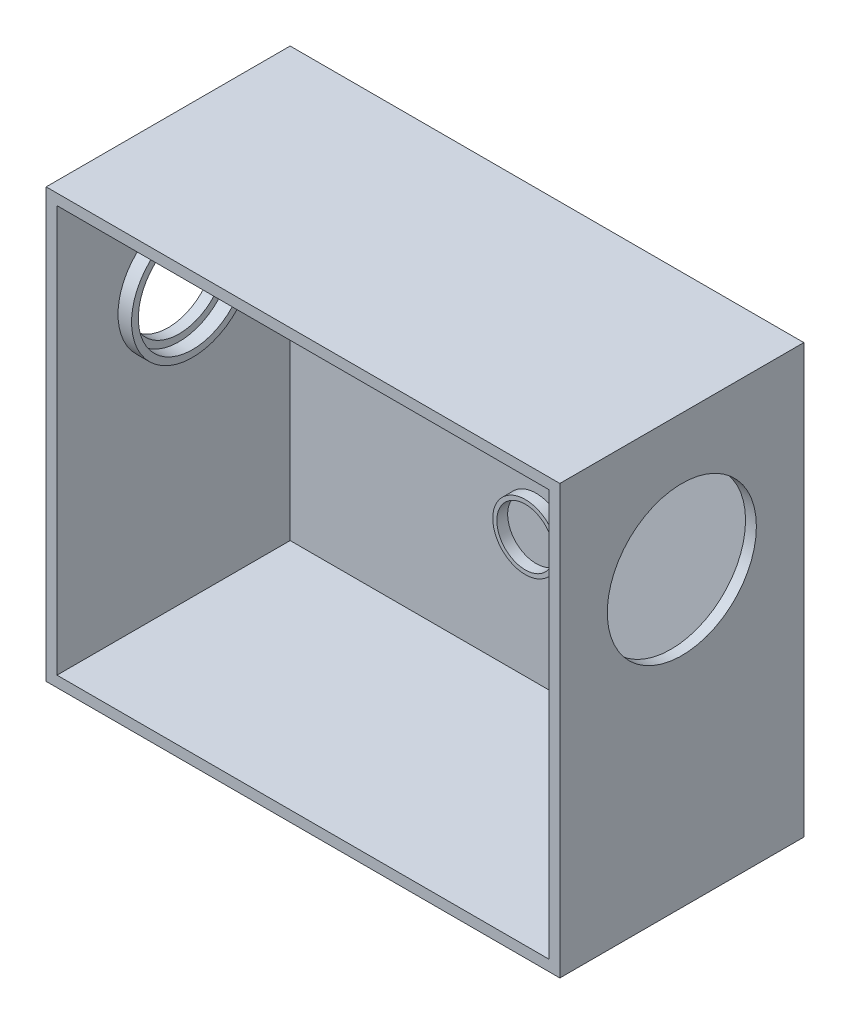
from build123d import *

# Parameters (mm, degrees)
CROQUIS1_W              = 379
CROQUIS1_H              = 316
SALIENTE_EXTRUIR1_DEPTH = 180
VACIADO1_T              = -8
CROQUIS2_R              = 35
CORTAR_EXTRUIR4_DEPTH   = 20
CROQUIS4_R              = 45
CROQUIS4_R_2            = 40
SALIENTE_EXTRUIR4_DEPTH = 10
CROQUIS6_R              = 55
CORTAR_EXTRUIR6_DEPTH   = 10
CROQUIS7_R              = 24
CROQUIS7_R_2            = 21
SALIENTE_EXTRUIR9_DEPTH = 8


with BuildPart() as part:
    # Croquis1 → Saliente-Extruir1 (new body)
    with BuildSketch(Plane.XY):
        Rectangle(CROQUIS1_W, CROQUIS1_H)
    extrude(amount=SALIENTE_EXTRUIR1_DEPTH)

    # Vaciado1
    vaciado1_openings = [part.faces().sort_by_distance(p)[0] for p in [
        (0, 0, 180),
    ]]
    offset(amount=VACIADO1_T, openings=vaciado1_openings, kind=Kind.INTERSECTION)

    # Croquis2 → Cortar-Extruir4 (cut)
    with BuildSketch(Plane.ZY.offset(189.5)):
        with Locations((90, 58)):
            Circle(CROQUIS2_R)
    extrude(amount=-CORTAR_EXTRUIR4_DEPTH, mode=Mode.SUBTRACT)

    # Croquis4 → Saliente-Extruir4 (add)
    with BuildSketch(Plane(origin=(-181.5, 0, 0), x_dir=(0, 0, -1), z_dir=(1, 0, 0))):
        with Locations((-90, 58)):
            Circle(CROQUIS4_R)
        with Locations((-90, 58)):
            Circle(CROQUIS4_R_2, mode=Mode.SUBTRACT)
    extrude(amount=SALIENTE_EXTRUIR4_DEPTH)

    # Croquis6 → Cortar-Extruir6 (cut)
    with BuildSketch(Plane(origin=(189.5, 0, 0), x_dir=(0, 0, -1), z_dir=(1, 0, 0))):
        with Locations((-90, 58)):
            Circle(CROQUIS6_R)
    extrude(amount=-CORTAR_EXTRUIR6_DEPTH, mode=Mode.SUBTRACT)

    # Croquis7 → Saliente-Extruir9 (add)
    with BuildSketch(Plane.XY.offset(8)):
        with Locations(Location((0, -53, 0), (0, 0, 180))):
            Circle(CROQUIS7_R)
        with Locations((0, -53)):
            Circle(CROQUIS7_R_2, mode=Mode.SUBTRACT)
    extrude(amount=SALIENTE_EXTRUIR9_DEPTH)


solid = part.part
